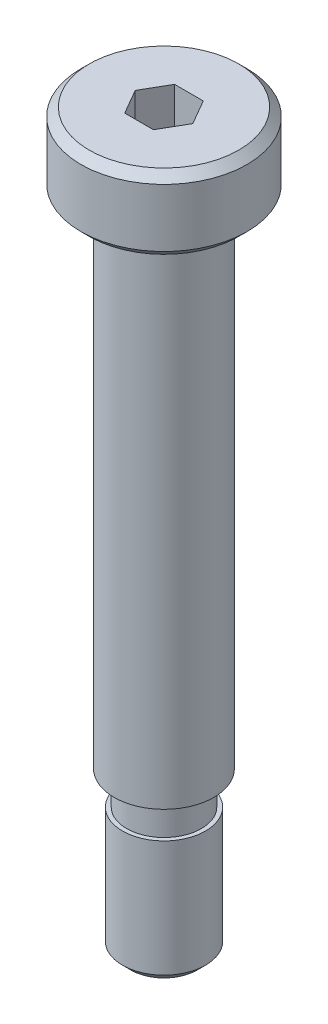
from build123d import *

# Parameters (mm, degrees)
CHAMFER1_SIZE      = 0.5
CUT_EXTRUDE1_DEPTH = 3


with BuildPart() as part:
    # Sketch1 → Revolve1 (revolve)
    with BuildSketch(Plane.XY):
        Polygon((0, 0), (5, 0), (5, -4.5), (2.75, -4.5), (2.75, -5), (3, -5), (3, -34.5), (2.25, -34.5), (2.25, -36.5), (2.5, -36.5), (2.5, -44), (0, -44), align=None)
    revolve(axis=Axis((0, 3, 0), (0, -1, 0)))

    # Chamfer1
    chamfer1_edges = [part.edges().sort_by_distance(p)[0] for p in [
        (-2.5, -44, 0),
        (-5, -4.5, 0),
        (-5, 0, 0),
    ]]
    chamfer(chamfer1_edges, length=CHAMFER1_SIZE)

    # Sketch2 → Cut-Extrude1 (cut)
    with BuildSketch(Plane(origin=(0, 0, 0), x_dir=(1, 0, 0), z_dir=(0, 1, 0))):
        Polygon((1.732050808, 0), (0.866025404, 1.5), (-0.866025404, 1.5), (-1.732050808, 0), (-0.866025404, -1.5), (0.866025404, -1.5), align=None)
    extrude(amount=-CUT_EXTRUDE1_DEPTH, mode=Mode.SUBTRACT)


solid = part.part
